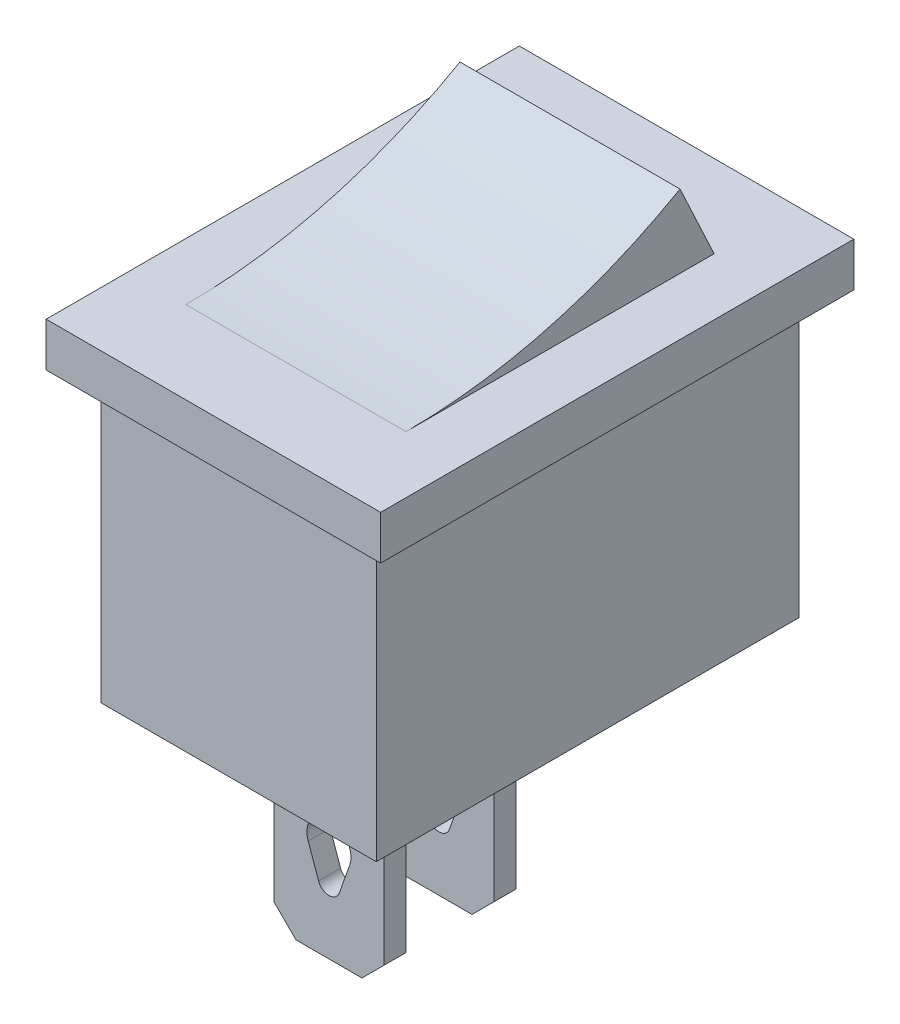
from build123d import *

# Parameters (mm, degrees)
SKETCH_1_W               = 12.5
SKETCH_1_H               = 19.2
EXTRUDE_1_DEPTH          = 13
SKETCH_2_W               = 5
SKETCH_2_H               = 1
EXTRUDE_2_DEPTH          = 9
CHAMFER_1_SIZE           = 1
CUT_EXTRUDE_1_DEPTH      = 18.608875603
CUT_EXTRUDE_1_DEPTH_BACK = 18.608875603
SKETCH_4_W               = 15.2
SKETCH_4_H               = 21.5
EXTRUDE_3_DEPTH          = 2
EXTRUDE_4_DEPTH          = 5


with BuildPart() as part:
    # Эскиз1 → Бобышка-Вытянуть1 (new body)
    with BuildSketch(Plane(origin=(0, 0, 0), x_dir=(1, 0, 0), z_dir=(0, 1, 0))):
        Rectangle(SKETCH_1_W, SKETCH_1_H)
    extrude(amount=EXTRUDE_1_DEPTH)

    # Эскиз2 → Бобышка-Вытянуть2 (add)
    with BuildSketch(Plane.XZ):
        Rectangle(SKETCH_2_W, SKETCH_2_H)
        with Locations((0, 5)):
            Rectangle(SKETCH_2_W, SKETCH_2_H)
    extrude(amount=EXTRUDE_2_DEPTH)

    # Фаска1
    chamfer_1_edges = [part.edges().sort_by_distance(p)[0] for p in [
        (2.5, -9, 5),
        (-2.5, -9, 5),
        (2.5, -9, 0),
        (-2.5, -9, 0),
    ]]
    chamfer(chamfer_1_edges, length=CHAMFER_1_SIZE)

    # Эскиз3 → Вырез-Вытянуть1 (cut, two sides: drawn at the far end of the back side and taken through both)
    with BuildSketch(Plane(origin=(0, 0, -0.5), x_dir=(-1, 0, 0), z_dir=(0, 0, -1)).offset(-CUT_EXTRUDE_1_DEPTH_BACK)):
        with BuildLine():
            Line((0.942809042, -4.833333333), (0.471404521, -6.166666667))
            ThreePointArc((0.471404521, -6.166666667), (0, -6.5), (-0.471404521, -6.166666667))
            Line((-0.471404521, -6.166666667), (-0.942809042, -4.833333333))
            ThreePointArc((-0.942809042, -4.833333333), (0, -3.5), (0.942809042, -4.833333333))
        make_face()
    extrude(amount=CUT_EXTRUDE_1_DEPTH + CUT_EXTRUDE_1_DEPTH_BACK, mode=Mode.SUBTRACT)

    # Эскиз4 → Бобышка-Вытянуть3 (add)
    with BuildSketch(Plane(origin=(0, 13, 0), x_dir=(1, 0, 0), z_dir=(0, 1, 0))):
        Rectangle(SKETCH_4_W, SKETCH_4_H)
    extrude(amount=EXTRUDE_3_DEPTH)

    # Эскиз5 → Бобышка-Вытянуть4 (add, symmetric)
    with BuildSketch(Plane(origin=(0, 0, 0), x_dir=(0, 0, -1), z_dir=(1, 0, 0))):
        with BuildLine():
            Line((-7, 15), (7, 15))
            Line((7, 15), (5.451254755, 18.321294895))
            ThreePointArc((5.451254755, 18.321294895), (-0.556694467, 15.844590382), (-7, 15))
        make_face()
    extrude(amount=EXTRUDE_4_DEPTH, both=True)


solid = part.part
